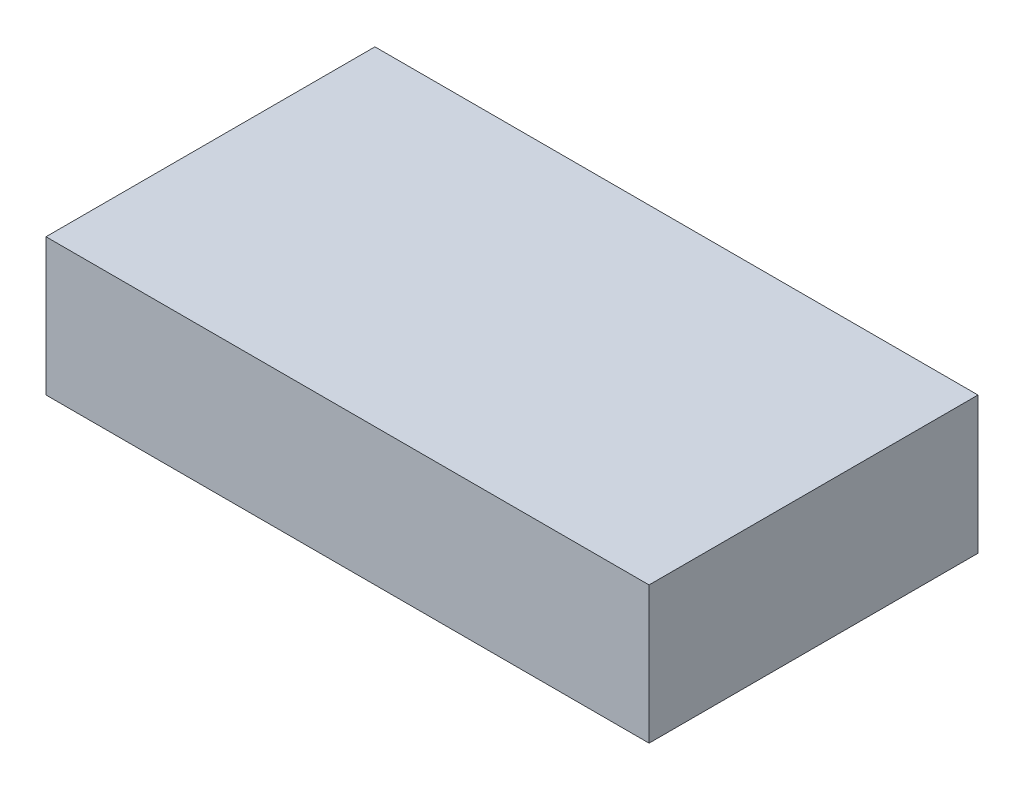
from build123d import *

# Parameters (mm, degrees)
SKETCH_2_W      = 22
SKETCH_2_H      = 12
EXTRUDE_1_DEPTH = 5


with BuildPart() as part:
    # 草图2 → 凸台-拉伸1 (new body)
    with BuildSketch(Plane(origin=(0, 0, 0), x_dir=(1, 0, 0), z_dir=(0, 1, 0))):
        with Locations((-38.526087995, -56.123686294)):
            Rectangle(SKETCH_2_W, SKETCH_2_H)
    extrude(amount=EXTRUDE_1_DEPTH)


solid = part.part
